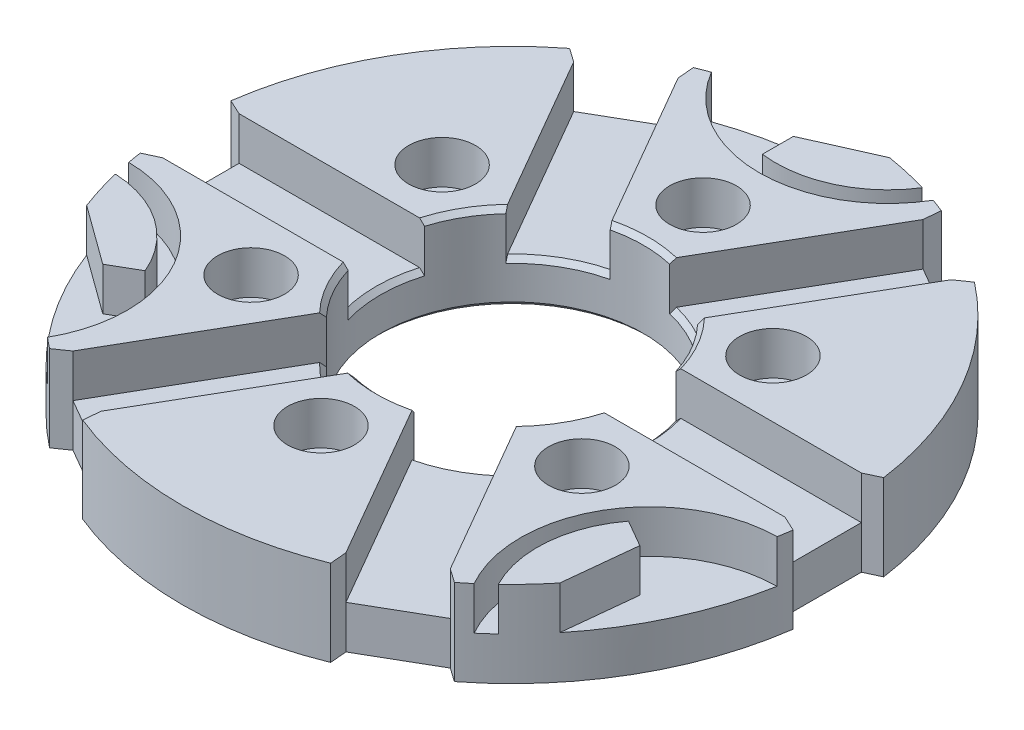
from build123d import *

# Parameters (mm, degrees)
SKETCH1_R                               = 69
BOSS_EXTRUDE1_DEPTH                     = 18
SKETCH2_R                               = 27.5
CUT_EXTRUDE1_DEPTH                      = 100.227012451
CUT_EXTRUDE2_DEPTH                      = 9
CUT_EXTRUDE3_START                      = -9
CUT_EXTRUDE3_DEPTH                      = 9
CIRPATTERN1_COUNT                       = 6
CUT_EXTRUDE4_START                      = -9
SKETCH5_R                               = 27
CUT_EXTRUDE4_DEPTH                      = 9
CIRPATTERN2_COUNT                       = 3
CBORE_FOR_M5_HEX_HEAD_BOLT1_D           = 9
CBORE_FOR_M5_HEX_HEAD_BOLT1_CBORE_D     = 14
CBORE_FOR_M5_HEX_HEAD_BOLT1_CBORE_DEPTH = 9
CIRPATTERN3_COUNT                       = 6
CHAMFER1_SIZE                           = 1


with BuildPart() as part:
    # Sketch1 → Boss-Extrude1 (new body)
    with BuildSketch(Plane(origin=(0, 0, 0), x_dir=(1, 0, 0), z_dir=(0, 1, 0))):
        with Locations(Location((0, 0, 0), (0, 0, 270))):
            Circle(SKETCH1_R)
    extrude(amount=BOSS_EXTRUDE1_DEPTH)

    # Sketch2 → Cut-Extrude1 (cut, through all)
    with BuildSketch(Plane(origin=(0, 18, 0), x_dir=(1, 0, 0), z_dir=(0, 1, 0))):
        with Locations(Location((0, 0, 0), (0, 0, 270))):
            Circle(SKETCH2_R)
    extrude(amount=-CUT_EXTRUDE1_DEPTH, mode=Mode.SUBTRACT)

    # Sketch3 → Cut-Extrude2 (cut)
    with BuildSketch(Plane(origin=(0, 18, 0), x_dir=(1, 0, 0), z_dir=(0, 1, 0))):
        with BuildLine():
            Line((-39.506230912, 52.426799156), (-20.083525347, 18.785686296))
            ThreePointArc((-20.083525347, 18.785686296), (-13.75, 23.815698604), (-6.227118887, 26.785686296))
            Line((-6.227118887, 26.785686296), (-25.649824452, 60.426799156))
            Line((-25.649824452, 60.426799156), (-25.956463368, 63.931698002))
            ThreePointArc((-25.956463368, 63.931698002), (-34.5, 59.755752861), (-42.388242893, 54.44480567))
            Line((-42.388242893, 54.44480567), (-39.506230912, 52.426799156))
        make_face()
    cut_extrude2 = extrude(amount=-CUT_EXTRUDE2_DEPTH, mode=Mode.SUBTRACT)

    # Sketch4 → Cut-Extrude3 (cut)
    with BuildSketch(Plane(origin=(0, 9, 0), x_dir=(1, 0, 0), z_dir=(0, 1, 0)).offset(CUT_EXTRUDE3_START)):
        with BuildLine():
            Line((-39.506230912, 52.426799156), (-25.649824452, 60.426799156))
            Line((-25.649824452, 60.426799156), (-25.956463368, 63.931698002))
            ThreePointArc((-25.956463368, 63.931698002), (-34.5, 59.755752861), (-42.388242893, 54.44480567))
            Line((-42.388242893, 54.44480567), (-39.506230912, 52.426799156))
        make_face()
    cut_extrude3 = extrude(amount=CUT_EXTRUDE3_DEPTH, mode=Mode.SUBTRACT)

    # CirPattern1: Cut-Extrude2, Cut-Extrude3 ×6 about axis
    cirpattern1_axis = Axis((0, 0, 0), (0, 1, 0))
    add([cut_extrude2.rotate(cirpattern1_axis, i * 360 / CIRPATTERN1_COUNT) for i in range(1, CIRPATTERN1_COUNT)], mode=Mode.SUBTRACT)
    add([cut_extrude3.rotate(cirpattern1_axis, i * 360 / CIRPATTERN1_COUNT) for i in range(1, CIRPATTERN1_COUNT)], mode=Mode.SUBTRACT)

    # Sketch5 → Cut-Extrude4 (cut)
    with BuildSketch(Plane(origin=(0, 18, 0), x_dir=(1, 0, 0), z_dir=(0, 1, 0)).offset(CUT_EXTRUDE4_START)):
        with Locations((-68.199500548, -39.375)):
            Circle(SKETCH5_R)
        with BuildLine():
            Line((-52.130681517, -33.561764622), (-46.514419424, -30.319214191))
            ThreePointArc((-46.514419424, -30.319214191), (-54.735535714, -20.114375634), (-67.143353435, -15.898744905))
            ThreePointArc((-67.143353435, -15.898744905), (-65.948291272, -20.29341958), (-64.465924789, -24.599685792))
            Line((-64.465924789, -24.599685792), (-52.130681517, -33.561764622))
        make_face(mode=Mode.SUBTRACT)
    cut_extrude4 = extrude(amount=CUT_EXTRUDE4_DEPTH, mode=Mode.SUBTRACT)

    # CirPattern2: Cut-Extrude4 ×3 about axis
    cirpattern2_axis = Axis((0, 0, 0), (0, 1, 0))
    for i in range(1, CIRPATTERN2_COUNT):
        add(cut_extrude4.rotate(cirpattern2_axis, i * 360 / CIRPATTERN2_COUNT), mode=Mode.SUBTRACT)

    # CBORE for M5 Hex Head Bolt1 (through all)
    with Locations(Plane(origin=(0, 18, -40), x_dir=(0, 0, 1), z_dir=(0, 1, 0))):
        with Locations((0, 0)):
            cbore_for_m5_hex_head_bolt1 = CounterBoreHole(CBORE_FOR_M5_HEX_HEAD_BOLT1_D / 2, CBORE_FOR_M5_HEX_HEAD_BOLT1_CBORE_D / 2, CBORE_FOR_M5_HEX_HEAD_BOLT1_CBORE_DEPTH)

    # CirPattern3: CBORE for M5 Hex Head Bolt1 ×6 about axis
    cirpattern3_axis = Axis((0, 0, 0), (0, 1, 0))
    for i in range(1, CIRPATTERN3_COUNT):
        add(cbore_for_m5_hex_head_bolt1.rotate(cirpattern3_axis, i * 360 / CIRPATTERN3_COUNT), mode=Mode.SUBTRACT)

    # Chamfer1
    chamfer1_edges = [part.edges().sort_by_distance(p)[0] for p in [
        (-23.815698604, 18, -13.75),
        (-27.5, 9, 0),
        (-13.75, 9, -23.815698604),
        (-23.815698604, 18, 13.75),
        (3.133977253, 18, 27.320837955),
        (23.815698604, 18, 13.75),
        (23.815698604, 18, -13.75),
        (0, 18, -27.5),
        (0, 0, -27.5),
        (13.75, 9, -23.815698604),
        (27.5, 9, 0),
        (13.75, 9, 23.815698604),
        (-13.75, 9, 23.815698604),
    ]]
    chamfer(chamfer1_edges, length=CHAMFER1_SIZE)


solid = part.part
